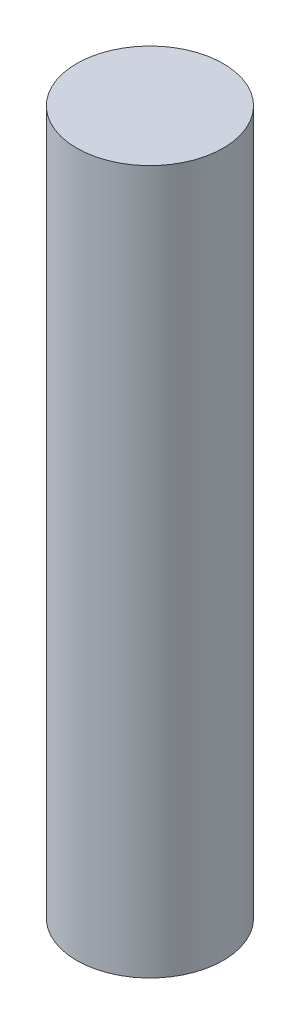
from build123d import *

# Parameters (mm, degrees)
BOSS_EXTRUDE1_DEPTH      = 2
BOSS_EXTRUDE1_DEPTH_BACK = 22
SKETCH1_R                = 2.5


with BuildPart() as part:
    # Sketch1 → Boss-Extrude1 (new, two sides: drawn at the far end of the back side and taken through both)
    with BuildSketch(Plane(origin=(0, 0, 0), x_dir=(1, 0, 0), z_dir=(0, 1, 0)).offset(-BOSS_EXTRUDE1_DEPTH_BACK)):
        with Locations(Location((0, 0, 0), (0, 0, 270))):
            Circle(SKETCH1_R)
    extrude(amount=BOSS_EXTRUDE1_DEPTH + BOSS_EXTRUDE1_DEPTH_BACK)


solid = part.part
